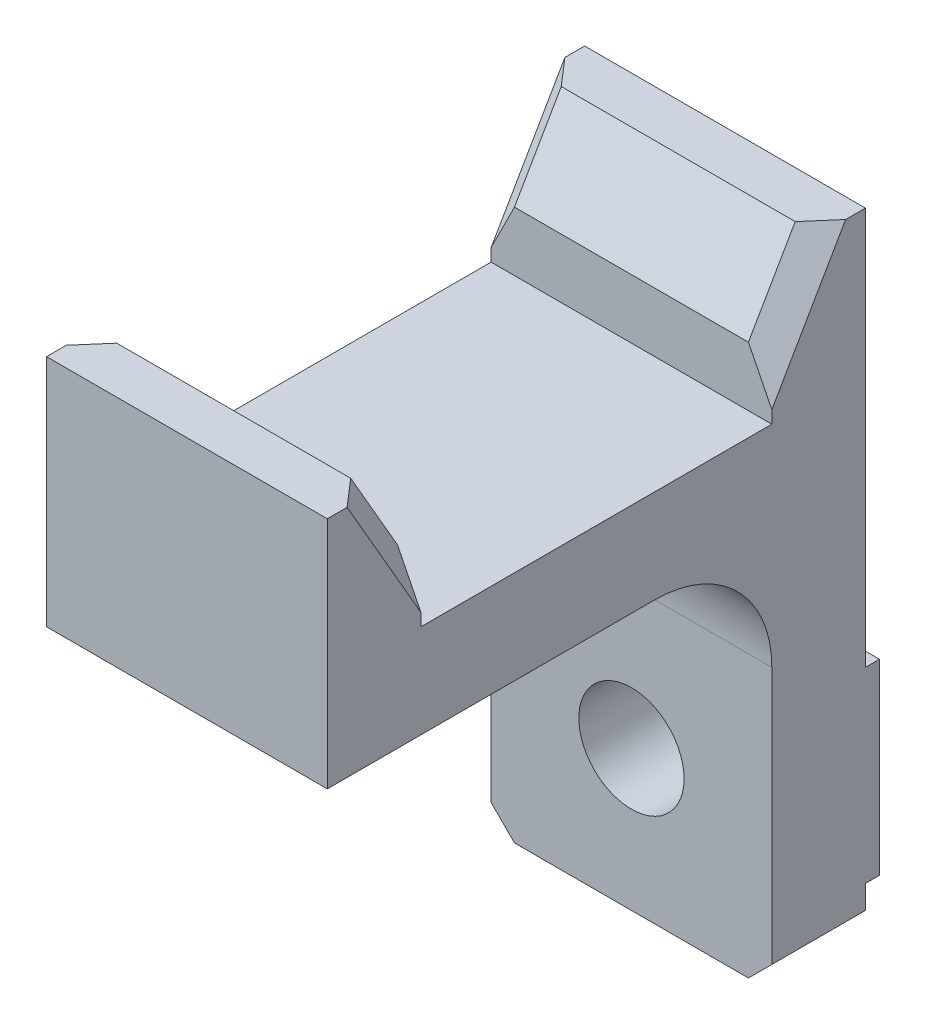
from build123d import *
from OCP.BRepFilletAPI import BRepFilletAPI_MakeChamfer

# Parameters (mm, degrees)
BOSS_EXTRUDE1_DEPTH = 6
SKETCH2_R           = 2.25
CUT_EXTRUDE1_DEPTH  = 29.948229652
CHAMFER1_SIZE       = 2
CHAMFER1_SIZE2      = 3.464101615
CHAMFER3_SIZE       = 1
CHAMFER4_SIZE       = 1
FILLET1_R           = 5


with BuildPart() as part:
    # Sketch1 → Boss-Extrude1 (new, symmetric)
    with BuildSketch(Plane(origin=(0, 0, 0), x_dir=(0, 0, -1), z_dir=(1, 0, 0))):
        Polygon((7.5, 6), (11.5, 6), (11.5, -11), (12.1, -11), (12.1, -19), (11.5, -19), (11.5, -21), (7.5, -21), (7.5, -4), (-11.5, -4), (-11.5, 6), (-7.5, 6), (-7.5, 0), (7.5, 0), align=None)
    extrude(amount=BOSS_EXTRUDE1_DEPTH, both=True)

    # Sketch2 → Cut-Extrude1 (cut, through all)
    with BuildSketch(Plane.XY.offset(-7.5)):
        with Locations((0, -15)):
            Circle(SKETCH2_R)
    extrude(amount=-CUT_EXTRUDE1_DEPTH, mode=Mode.SUBTRACT)

    # Chamfer1: one chamfer whose edges measure the first distance from different faces: ONE call of the kernel's chamfer builder (chamfer() names one face for all edges)
    chamfer1_edges_1 = [part.edges().sort_by_distance(p)[0] for p in [
        (0, 6, -7.5),
    ]]
    chamfer1_side_1 = [part.faces().sort_by_distance(p)[0] for p in [
        (0, 6, -9.5),
    ]]
    chamfer1_edges_2 = [part.edges().sort_by_distance(p)[0] for p in [
        (0, 6, 7.5),
    ]]
    chamfer1_side_2 = [part.faces().sort_by_distance(p)[0] for p in [
        (0, 6, 9.5),
    ]]
    chamfer1 = BRepFilletAPI_MakeChamfer(part.part.solid().wrapped)
    for e in chamfer1_edges_1:
        chamfer1.Add(CHAMFER1_SIZE, CHAMFER1_SIZE2, e.wrapped, chamfer1_side_1[0].wrapped)  # the first distance lies on this face
    for e in chamfer1_edges_2:
        chamfer1.Add(CHAMFER1_SIZE, CHAMFER1_SIZE2, e.wrapped, chamfer1_side_2[0].wrapped)  # the first distance lies on this face
    add(Compound.cast(chamfer1.Shape()), mode=Mode.REPLACE)

    # Chamfer3
    chamfer3_edges = [part.edges().sort_by_distance(p)[0] for p in [
        (-6, 4.267949192, -8.5),
        (-6, 4.267949192, 8.5),
        (6, 4.267949192, -8.5),
        (6, 4.267949192, 8.5),
    ]]
    chamfer(chamfer3_edges, length=CHAMFER3_SIZE)

    # Chamfer4
    chamfer4_edges = [part.edges().sort_by_distance(p)[0] for p in [
        (-6, -21, -9.5),
        (6, -21, -9.5),
    ]]
    chamfer(chamfer4_edges, length=CHAMFER4_SIZE)

    # Fillet1
    fillet1_edges = [part.edges().sort_by_distance(p)[0] for p in [
        (0, -4, -7.5),
    ]]
    fillet(fillet1_edges, radius=FILLET1_R)


solid = part.part
